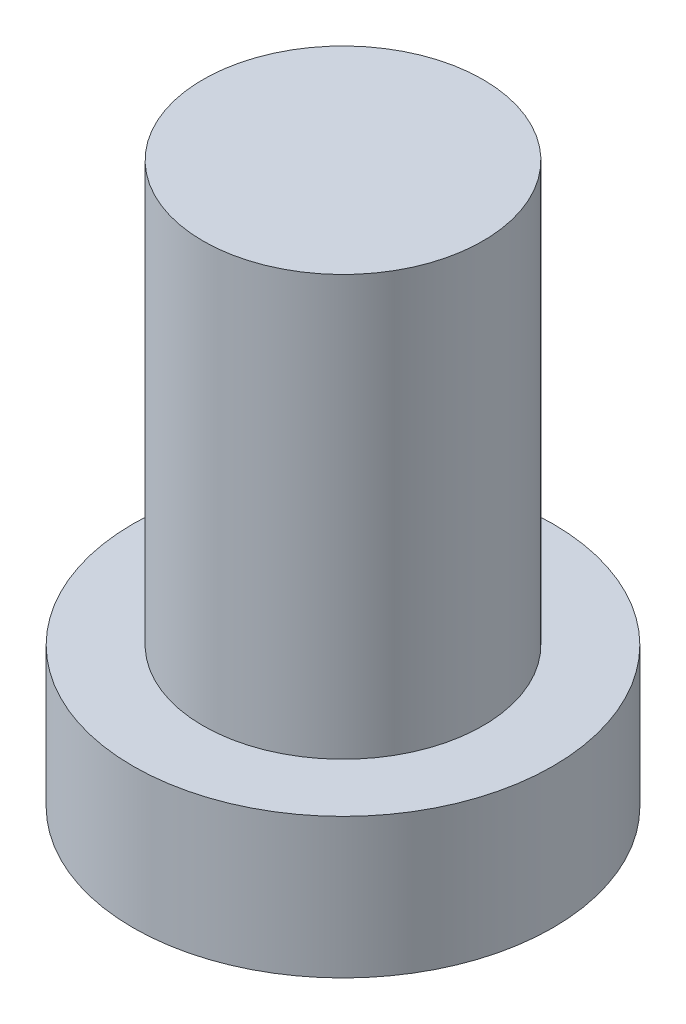
from build123d import *

# Parameters (mm, degrees)
ESBO_O1_R                = 15
RESSALTO_EXTRUS_O1_DEPTH = 10
ESBO_O2_R                = 10
RESSALTO_EXTRUS_O2_DEPTH = 30


with BuildPart() as part:
    # Esboço1 → Ressalto-extrusão1 (new body)
    with BuildSketch(Plane(origin=(0, 0, 0), x_dir=(1, 0, 0), z_dir=(0, 1, 0))):
        with Locations(Location((0, 0, 0), (0, 0, 270))):
            Circle(ESBO_O1_R)
    extrude(amount=RESSALTO_EXTRUS_O1_DEPTH)

    # Esboço2 → Ressalto-extrusão2 (add)
    with BuildSketch(Plane(origin=(0, 10, 0), x_dir=(1, 0, 0), z_dir=(0, 1, 0))):
        with Locations(Location((0, 0, 0), (0, 0, 270))):
            Circle(ESBO_O2_R)
    extrude(amount=RESSALTO_EXTRUS_O2_DEPTH)


solid = part.part
